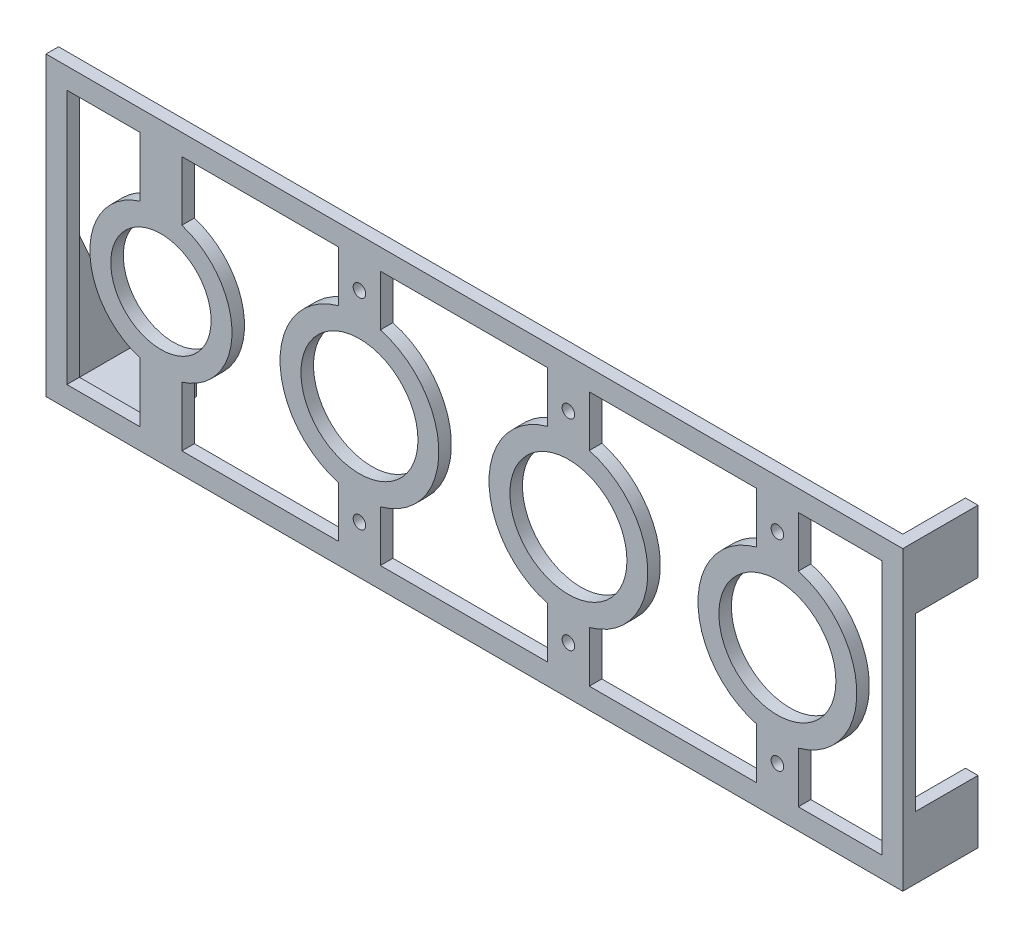
from build123d import *

# Parameters (mm, degrees)
SKETCH1_W           = 205
SKETCH1_H           = 71
SKETCH1_R           = 14
SKETCH1_R_2         = 12
SKETCH1_R_3         = 1.5
BOSS_EXTRUDE1_DEPTH = 3
SKETCH2_W           = 3
SKETCH2_H           = 15
BOSS_EXTRUDE2_DEPTH = 15
BOSS_EXTRUDE3_START = -71
SKETCH2_2_W         = 3
SKETCH2_2_H         = 15
BOSS_EXTRUDE3_DEPTH = 15
SKETCH4_W           = 15
SKETCH4_H           = 3
BOSS_EXTRUDE4_DEPTH = 18
BOSS_EXTRUDE5_DEPTH = 3
CUT_EXTRUDE1_REACH  = 219.692


with BuildPart() as part:
    # Sketch1 → Boss-Extrude1 (new body)
    with BuildSketch(Plane.XY):
        with Locations((-102.5, 35.5)):
            Rectangle(SKETCH1_W, SKETCH1_H)
        with Locations((-30, 35.5)):
            Circle(SKETCH1_R, mode=Mode.SUBTRACT)
        with Locations((-80, 35.5)):
            Circle(SKETCH1_R, mode=Mode.SUBTRACT)
        with Locations((-130, 35.5)):
            Circle(SKETCH1_R, mode=Mode.SUBTRACT)
        with Locations((-177.5, 35.5)):
            Circle(SKETCH1_R_2, mode=Mode.SUBTRACT)
        with Locations((-30, 59.5)):
            Circle(SKETCH1_R_3, mode=Mode.SUBTRACT)
        with Locations((-30, 11.5)):
            Circle(SKETCH1_R_3, mode=Mode.SUBTRACT)
        with Locations((-80, 59.5)):
            Circle(SKETCH1_R_3, mode=Mode.SUBTRACT)
        with Locations((-80, 11.5)):
            Circle(SKETCH1_R_3, mode=Mode.SUBTRACT)
        with Locations((-130, 59.5)):
            Circle(SKETCH1_R_3, mode=Mode.SUBTRACT)
        with Locations((-130, 11.5)):
            Circle(SKETCH1_R_3, mode=Mode.SUBTRACT)
    extrude(amount=BOSS_EXTRUDE1_DEPTH)

    # Sketch2 → Boss-Extrude2 (add)
    with BuildSketch(Plane(origin=(0, 71, 0), x_dir=(1, 0, 0), z_dir=(0, 1, 0))):
        with Locations((-1.5, 7.5)):
            Rectangle(SKETCH2_W, SKETCH2_H)
    extrude(amount=-BOSS_EXTRUDE2_DEPTH)

    # Sketch2<2> → Boss-Extrude3 (add)
    with BuildSketch(Plane(origin=(0, 71, 0), x_dir=(1, 0, 0), z_dir=(0, 1, 0)).offset(BOSS_EXTRUDE3_START)):
        with Locations((-1.5, 7.5)):
            Rectangle(SKETCH2_2_W, SKETCH2_2_H)
    extrude(amount=BOSS_EXTRUDE3_DEPTH)

    # Sketch4 → Boss-Extrude4 (add)
    with BuildSketch(Plane.ZY.offset(205)):
        with Locations((-7.5, 1.5)):
            Rectangle(SKETCH4_W, SKETCH4_H)
    extrude(amount=-BOSS_EXTRUDE4_DEPTH)

    # Sketch5 → Boss-Extrude5 (add)
    with BuildSketch(Plane.ZY.offset(205)):
        Polygon((0, 37), (-15, 3), (0, 3), align=None)
    extrude(amount=-BOSS_EXTRUDE5_DEPTH)

    # Sketch6 → Cut-Extrude1 (cut, up to next)
    with BuildSketch(Plane.XY.offset(3), mode=Mode.PRIVATE) as cut_extrude1_sk1:
        with BuildLine():
            ThreePointArc((-182.5, 51.748076809), (-194.5, 35.5), (-182.5, 19.251923191))
            Line((-182.5, 19.251923191), (-182.5, 5))
            Line((-182.5, 5), (-200, 5))
            Line((-200, 5), (-200, 66))
            Line((-200, 66), (-182.5, 66))
            Line((-182.5, 66), (-182.5, 51.748076809))
        make_face()
    cut_extrude1_tool1 = extrude(cut_extrude1_sk1.sketch, amount=-CUT_EXTRUDE1_REACH, mode=Mode.PRIVATE) & part.part
    # Sketch6 → Cut-Extrude1 (cut, up to next)
    with BuildSketch(Plane.XY.offset(3), mode=Mode.PRIVATE) as cut_extrude1_sk2:
        with BuildLine():
            ThreePointArc((-135, 53.83030278), (-149, 35.5), (-135, 17.16969722))
            Line((-135, 17.16969722), (-135, 5))
            Line((-135, 5), (-172.5, 5))
            Line((-172.5, 5), (-172.5, 19.251923191))
            ThreePointArc((-172.5, 19.251923191), (-160.5, 35.5), (-172.5, 51.748076809))
            Line((-172.5, 51.748076809), (-172.5, 66))
            Line((-172.5, 66), (-135, 66))
            Line((-135, 66), (-135, 53.83030278))
        make_face()
    cut_extrude1_tool2 = extrude(cut_extrude1_sk2.sketch, amount=-CUT_EXTRUDE1_REACH, mode=Mode.PRIVATE) & part.part
    # Sketch6 → Cut-Extrude1 (cut, up to next)
    with BuildSketch(Plane.XY.offset(3), mode=Mode.PRIVATE) as cut_extrude1_sk3:
        with BuildLine():
            ThreePointArc((-125, 17.16969722), (-111, 35.5), (-125, 53.83030278))
            Line((-125, 53.83030278), (-125, 66))
            Line((-125, 66), (-85, 66))
            Line((-85, 66), (-85, 53.83030278))
            ThreePointArc((-85, 53.83030278), (-99, 35.5), (-85, 17.16969722))
            Line((-85, 17.16969722), (-85, 5))
            Line((-85, 5), (-125, 5))
            Line((-125, 5), (-125, 17.16969722))
        make_face()
    cut_extrude1_tool3 = extrude(cut_extrude1_sk3.sketch, amount=-CUT_EXTRUDE1_REACH, mode=Mode.PRIVATE) & part.part
    # Sketch6 → Cut-Extrude1 (cut, up to next)
    with BuildSketch(Plane.XY.offset(3), mode=Mode.PRIVATE) as cut_extrude1_sk4:
        with BuildLine():
            ThreePointArc((-75, 17.16969722), (-61, 35.5), (-75, 53.83030278))
            Line((-75, 53.83030278), (-75, 66))
            Line((-75, 66), (-35, 66))
            Line((-35, 66), (-35, 53.83030278))
            ThreePointArc((-35, 53.83030278), (-49, 35.5), (-35, 17.16969722))
            Line((-35, 17.16969722), (-35, 5))
            Line((-35, 5), (-75, 5))
            Line((-75, 5), (-75, 17.16969722))
        make_face()
    cut_extrude1_tool4 = extrude(cut_extrude1_sk4.sketch, amount=-CUT_EXTRUDE1_REACH, mode=Mode.PRIVATE) & part.part
    # Sketch6 → Cut-Extrude1 (cut, up to next)
    with BuildSketch(Plane.XY.offset(3), mode=Mode.PRIVATE) as cut_extrude1_sk5:
        with BuildLine():
            ThreePointArc((-25, 17.16969722), (-11, 35.5), (-25, 53.83030278))
            Line((-25, 53.83030278), (-25, 66))
            Line((-25, 66), (-5, 66))
            Line((-5, 66), (-5, 5))
            Line((-5, 5), (-25, 5))
            Line((-25, 5), (-25, 17.16969722))
        make_face()
    cut_extrude1_tool5 = extrude(cut_extrude1_sk5.sketch, amount=-CUT_EXTRUDE1_REACH, mode=Mode.PRIVATE) & part.part
    add(cut_extrude1_tool1.solids().sort_by_distance((-195.134606, 35.5, 3))[0], mode=Mode.SUBTRACT)
    add(cut_extrude1_tool2.solids().sort_by_distance((-154.340944, 35.5, 3))[0], mode=Mode.SUBTRACT)
    add(cut_extrude1_tool3.solids().sort_by_distance((-105, 35.5, 3))[0], mode=Mode.SUBTRACT)
    add(cut_extrude1_tool4.solids().sort_by_distance((-55, 35.5, 3))[0], mode=Mode.SUBTRACT)
    add(cut_extrude1_tool5.solids().sort_by_distance((-10.35805, 35.5, 3))[0], mode=Mode.SUBTRACT)


solid = part.part
